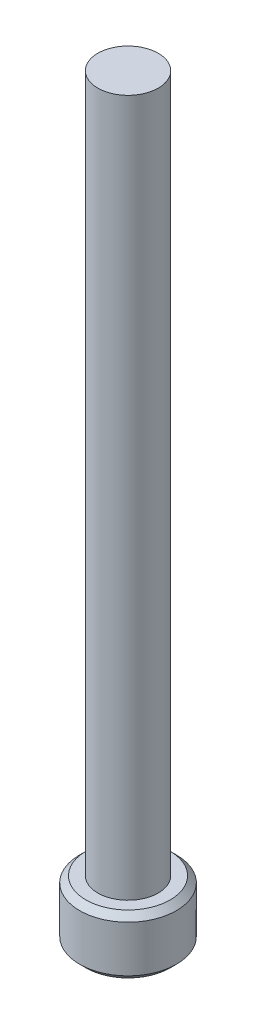
from build123d import *

# Parameters (mm, degrees)
SKETCH1_R           = 2.4765
BOSS_EXTRUDE1_DEPTH = 57.15
SKETCH2_R           = 3.9624
BOSS_EXTRUDE2_DEPTH = 4.826
CUT_EXTRUDE1_DEPTH  = 2.286
CHAMFER1_SIZE       = 0.508


with BuildPart() as part:
    # Sketch1 → Boss-Extrude1 (new body)
    with BuildSketch(Plane(origin=(0, 0, 0), x_dir=(1, 0, 0), z_dir=(0, 1, 0))):
        with Locations(Location((0, 0, 0), (0, 0, 270))):
            Circle(SKETCH1_R)
    extrude(amount=BOSS_EXTRUDE1_DEPTH)

    # Sketch2 → Boss-Extrude2 (add)
    with BuildSketch(Plane.XZ):
        with Locations(Location((0, 0, 0), (0, 0, 270))):
            Circle(SKETCH2_R)
    extrude(amount=BOSS_EXTRUDE2_DEPTH)

    # Sketch3 → Cut-Extrude1 (cut)
    with BuildSketch(Plane.XZ.offset(4.826)):
        Polygon((2.291358881, 0), (1.14567944, 1.984375), (-1.14567944, 1.984375), (-2.291358881, 0), (-1.14567944, -1.984375), (1.14567944, -1.984375), align=None)
    extrude(amount=-CUT_EXTRUDE1_DEPTH, mode=Mode.SUBTRACT)

    # Chamfer1
    chamfer1_edges = [part.edges().sort_by_distance(p)[0] for p in [
        (0, 0, 3.9624),
        (0, -4.826, 3.9624),
    ]]
    chamfer(chamfer1_edges, length=CHAMFER1_SIZE)


solid = part.part
